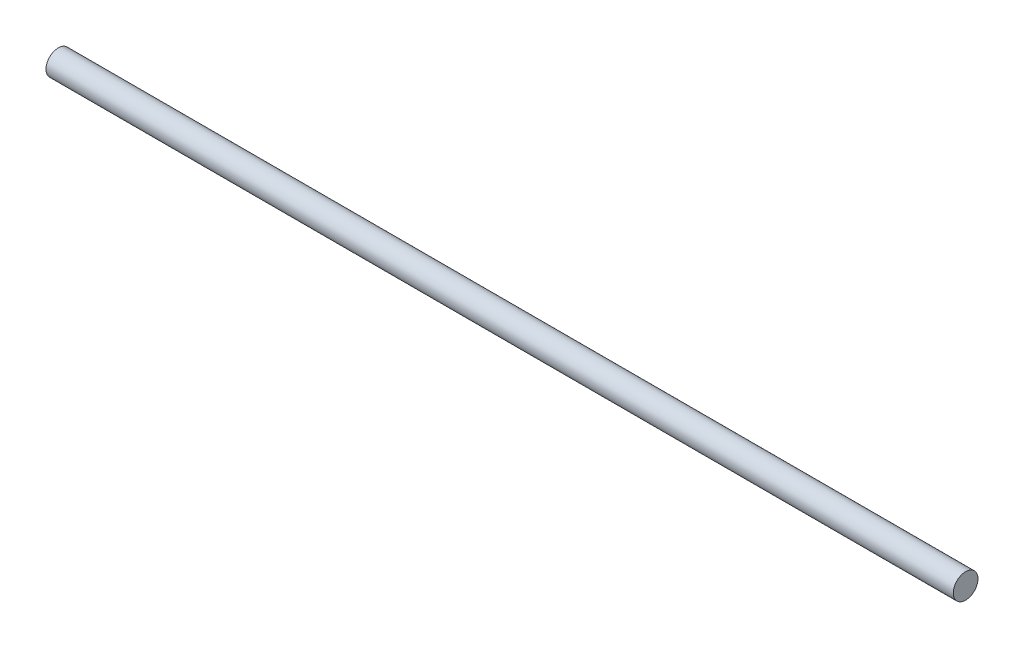
from build123d import *

# Parameters (mm, degrees)
SKETCH2_R           = 1.5
BOSS_EXTRUDE1_DEPTH = 110


with BuildPart() as part:
    # Sketch2 → Boss-Extrude1 (new body)
    with BuildSketch(Plane(origin=(0, 0, 0), x_dir=(0, 0, -1), z_dir=(1, 0, 0))):
        Circle(SKETCH2_R)
    extrude(amount=BOSS_EXTRUDE1_DEPTH)


solid = part.part
